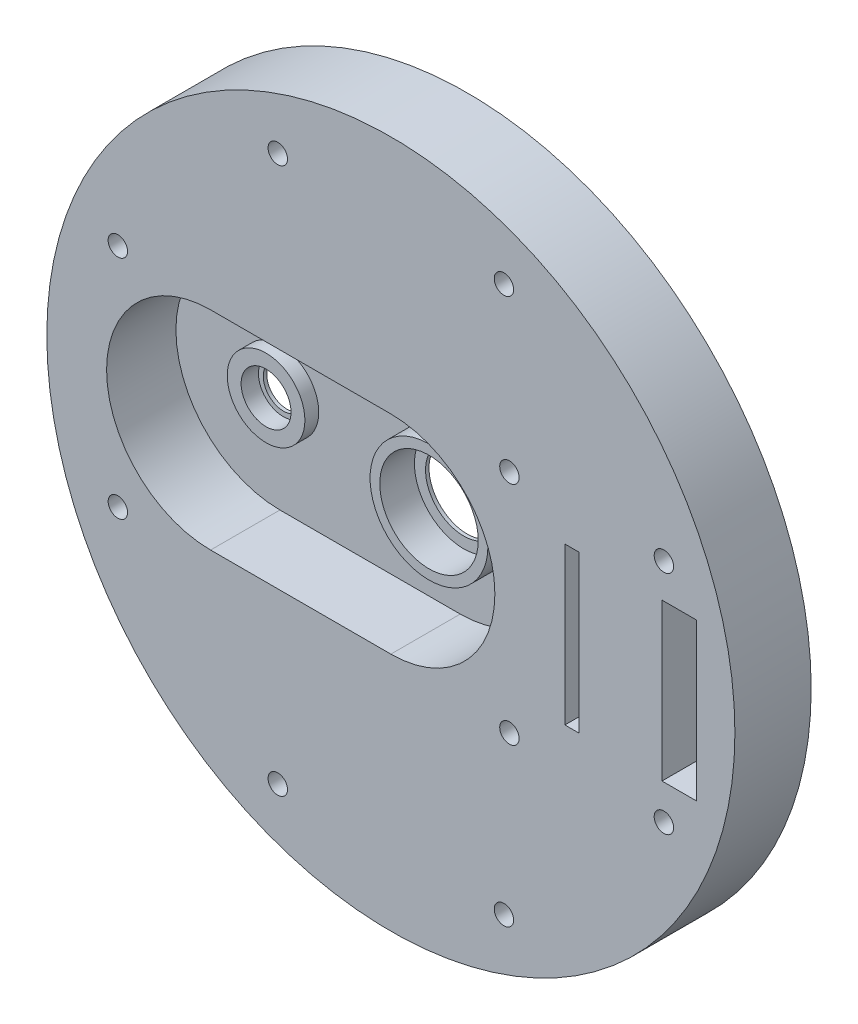
from build123d import *

# Parameters (mm, degrees)
SKETCH1_R                          = 49.62
BASE_DEPTH                         = 1
SKETCH6_R                          = 49.62
WALLS_DEPTH                        = 10
SKETCH8_R                          = 3.6
PINION_BEARING_POCKET_DEPTH        = 0.5
PINION_BEARING_HOLE_REACH          = 72.954
SKETCH9_R                          = 2.9
TALLER_START                       = 2
SKETCH10_R                         = 5.6
SKETCH10_R_2                       = 3.6
TALLER_PINION_BEARING_POCKET_DEPTH = 2
SKETCH11_R                         = 7.1
GEAR_BEARING_POCKET_DEPTH          = 0.5
GEAR_BEARING_HOLE_REACH            = 72.954
SKETCH12_R                         = 5.5
TALLER_START_2                     = 4.5
SKETCH13_R                         = 8.5
SKETCH13_R_2                       = 7.1
TALLER_GEAR_BEARING_POCKET_DEPTH   = 4.5
SCREW_HOLES_REACH                  = 73.03
SKETCH16_R                         = 1.4
SKETCH18_W                         = 2
SKETCH18_H                         = 22.6
FLEX_CABLE_DEPTH                   = 72.030196396
CUT_EXTRUDE1_REACH                 = 73.03
SKETCH19_R                         = 1.4
SKETCH19_W                         = 5
SKETCH19_H                         = 22.6


with BuildPart() as part:
    # Sketch1 → Base (new body)
    with BuildSketch(Plane.XY):
        Circle(SKETCH1_R)
    extrude(amount=BASE_DEPTH)

    # Sketch6 → Walls (add)
    with BuildSketch(Plane.XY.offset(1)):
        Circle(SKETCH6_R)
        with BuildLine():
            Line((-26, 15), (0, 15))
            ThreePointArc((0, 15), (15, 0), (0, -15))
            Line((0, -15), (-26, -15))
            ThreePointArc((-26, -15), (-41, 0), (-26, 15))
        make_face(mode=Mode.SUBTRACT)
    extrude(amount=WALLS_DEPTH)

    # Sketch8 → Pinion bearing pocket (cut)
    with BuildSketch(Plane.XY.offset(1)):
        with Locations((-26, 0)):
            Circle(SKETCH8_R)
    extrude(amount=-PINION_BEARING_POCKET_DEPTH, mode=Mode.SUBTRACT)

    # Sketch9 → Pinion bearing hole (cut, up to next)
    with BuildSketch(Plane.XY.offset(0.5), mode=Mode.PRIVATE) as pinion_bearing_hole_sk1:
        with Locations((-26, 0)):
            Circle(SKETCH9_R)
    pinion_bearing_hole_tool1 = extrude(pinion_bearing_hole_sk1.sketch, amount=-PINION_BEARING_HOLE_REACH, mode=Mode.PRIVATE) & part.part
    add(pinion_bearing_hole_tool1.solids().sort_by_distance((-26, 0, 0.5))[0], mode=Mode.SUBTRACT)

    # Sketch10 → Taller pinion bearing pocket (add)
    with BuildSketch(Plane.XY.offset(1).offset(TALLER_START)):
        with Locations((-26, 0)):
            Circle(SKETCH10_R)
        with Locations((-26, 0)):
            Circle(SKETCH10_R_2, mode=Mode.SUBTRACT)
    extrude(amount=-TALLER_PINION_BEARING_POCKET_DEPTH)

    # Sketch11 → Gear bearing pocket (cut)
    with BuildSketch(Plane.XY.offset(1)):
        Circle(SKETCH11_R)
    extrude(amount=-GEAR_BEARING_POCKET_DEPTH, mode=Mode.SUBTRACT)

    # Sketch12 → Gear bearing hole (cut, up to next)
    with BuildSketch(Plane.XY.offset(0.5), mode=Mode.PRIVATE) as gear_bearing_hole_sk1:
        Circle(SKETCH12_R)
    gear_bearing_hole_tool1 = extrude(gear_bearing_hole_sk1.sketch, amount=-GEAR_BEARING_HOLE_REACH, mode=Mode.PRIVATE) & part.part
    add(gear_bearing_hole_tool1.solids().sort_by_distance((0, 0, 0.5))[0], mode=Mode.SUBTRACT)

    # Sketch13 → Taller gear bearing pocket (add)
    with BuildSketch(Plane.XY.offset(1).offset(TALLER_START_2)):
        Circle(SKETCH13_R)
        Circle(SKETCH13_R_2, mode=Mode.SUBTRACT)
    extrude(amount=-TALLER_GEAR_BEARING_POCKET_DEPTH)

    # Sketch16 → Screw holes (cut, up to next)
    with BuildSketch(Plane.XY.offset(11), mode=Mode.PRIVATE) as screw_holes_sk1:
        with Locations((-39.375745676, 16.309967887)):
            Circle(SKETCH16_R)
    screw_holes_tool1 = extrude(screw_holes_sk1.sketch, amount=-SCREW_HOLES_REACH, mode=Mode.PRIVATE) & part.part
    # Sketch16 → Screw holes (cut, up to next)
    with BuildSketch(Plane.XY.offset(11), mode=Mode.PRIVATE) as screw_holes_sk2:
        with Locations((-16.309967887, 39.375745676)):
            Circle(SKETCH16_R)
    screw_holes_tool2 = extrude(screw_holes_sk2.sketch, amount=-SCREW_HOLES_REACH, mode=Mode.PRIVATE) & part.part
    # Sketch16 → Screw holes (cut, up to next)
    with BuildSketch(Plane.XY.offset(11), mode=Mode.PRIVATE) as screw_holes_sk3:
        with Locations((16.309967887, 39.375745676)):
            Circle(SKETCH16_R)
    screw_holes_tool3 = extrude(screw_holes_sk3.sketch, amount=-SCREW_HOLES_REACH, mode=Mode.PRIVATE) & part.part
    # Sketch16 → Screw holes (cut, up to next)
    with BuildSketch(Plane.XY.offset(11), mode=Mode.PRIVATE) as screw_holes_sk4:
        with Locations((39.375745676, 16.309967887)):
            Circle(SKETCH16_R)
    screw_holes_tool4 = extrude(screw_holes_sk4.sketch, amount=-SCREW_HOLES_REACH, mode=Mode.PRIVATE) & part.part
    # Sketch16 → Screw holes (cut, up to next)
    with BuildSketch(Plane.XY.offset(11), mode=Mode.PRIVATE) as screw_holes_sk5:
        with Locations((39.375745676, -16.309967887)):
            Circle(SKETCH16_R)
    screw_holes_tool5 = extrude(screw_holes_sk5.sketch, amount=-SCREW_HOLES_REACH, mode=Mode.PRIVATE) & part.part
    # Sketch16 → Screw holes (cut, up to next)
    with BuildSketch(Plane.XY.offset(11), mode=Mode.PRIVATE) as screw_holes_sk6:
        with Locations((16.309967887, -39.375745676)):
            Circle(SKETCH16_R)
    screw_holes_tool6 = extrude(screw_holes_sk6.sketch, amount=-SCREW_HOLES_REACH, mode=Mode.PRIVATE) & part.part
    # Sketch16 → Screw holes (cut, up to next)
    with BuildSketch(Plane.XY.offset(11), mode=Mode.PRIVATE) as screw_holes_sk7:
        with Locations((-16.309967887, -39.375745676)):
            Circle(SKETCH16_R)
    screw_holes_tool7 = extrude(screw_holes_sk7.sketch, amount=-SCREW_HOLES_REACH, mode=Mode.PRIVATE) & part.part
    # Sketch16 → Screw holes (cut, up to next)
    with BuildSketch(Plane.XY.offset(11), mode=Mode.PRIVATE) as screw_holes_sk8:
        with Locations((-39.375745676, -16.309967887)):
            Circle(SKETCH16_R)
    screw_holes_tool8 = extrude(screw_holes_sk8.sketch, amount=-SCREW_HOLES_REACH, mode=Mode.PRIVATE) & part.part
    add(screw_holes_tool1.solids().sort_by_distance((-39.375746, 16.309968, 11))[0], mode=Mode.SUBTRACT)
    add(screw_holes_tool2.solids().sort_by_distance((-16.309968, 39.375746, 11))[0], mode=Mode.SUBTRACT)
    add(screw_holes_tool3.solids().sort_by_distance((16.309968, 39.375746, 11))[0], mode=Mode.SUBTRACT)
    add(screw_holes_tool4.solids().sort_by_distance((39.375746, 16.309968, 11))[0], mode=Mode.SUBTRACT)
    add(screw_holes_tool5.solids().sort_by_distance((39.375746, -16.309968, 11))[0], mode=Mode.SUBTRACT)
    add(screw_holes_tool6.solids().sort_by_distance((16.309968, -39.375746, 11))[0], mode=Mode.SUBTRACT)
    add(screw_holes_tool7.solids().sort_by_distance((-16.309968, -39.375746, 11))[0], mode=Mode.SUBTRACT)
    add(screw_holes_tool8.solids().sort_by_distance((-39.375746, -16.309968, 11))[0], mode=Mode.SUBTRACT)

    # Sketch18 → Flex cable (cut, through all)
    with BuildSketch(Plane.XY):
        with Locations((26.1, 0)):
            Rectangle(SKETCH18_W, SKETCH18_H)
    extrude(amount=FLEX_CABLE_DEPTH, mode=Mode.SUBTRACT)

    # Sketch19 → Cut-Extrude1 (cut, up to next)
    with BuildSketch(Plane.XY, mode=Mode.PRIVATE) as cut_extrude1_sk1:
        with Locations((17.1, 16.3)):
            Circle(SKETCH19_R)
    cut_extrude1_tool1 = extrude(cut_extrude1_sk1.sketch, amount=CUT_EXTRUDE1_REACH, mode=Mode.PRIVATE) & part.part
    # Sketch19 → Cut-Extrude1 (cut, up to next)
    with BuildSketch(Plane.XY, mode=Mode.PRIVATE) as cut_extrude1_sk2:
        with Locations((17.1, -16.3)):
            Circle(SKETCH19_R)
    cut_extrude1_tool2 = extrude(cut_extrude1_sk2.sketch, amount=CUT_EXTRUDE1_REACH, mode=Mode.PRIVATE) & part.part
    # Sketch19 → Cut-Extrude1 (cut, up to next)
    with BuildSketch(Plane.XY, mode=Mode.PRIVATE) as cut_extrude1_sk3:
        with Locations((41.6, 0)):
            Rectangle(SKETCH19_W, SKETCH19_H)
    cut_extrude1_tool3 = extrude(cut_extrude1_sk3.sketch, amount=CUT_EXTRUDE1_REACH, mode=Mode.PRIVATE) & part.part
    add(cut_extrude1_tool1.solids().sort_by_distance((17.1, 16.3, 0))[0], mode=Mode.SUBTRACT)
    add(cut_extrude1_tool2.solids().sort_by_distance((17.1, -16.3, 0))[0], mode=Mode.SUBTRACT)
    add(cut_extrude1_tool3.solids().sort_by_distance((41.6, 0, 0))[0], mode=Mode.SUBTRACT)


solid = part.part
